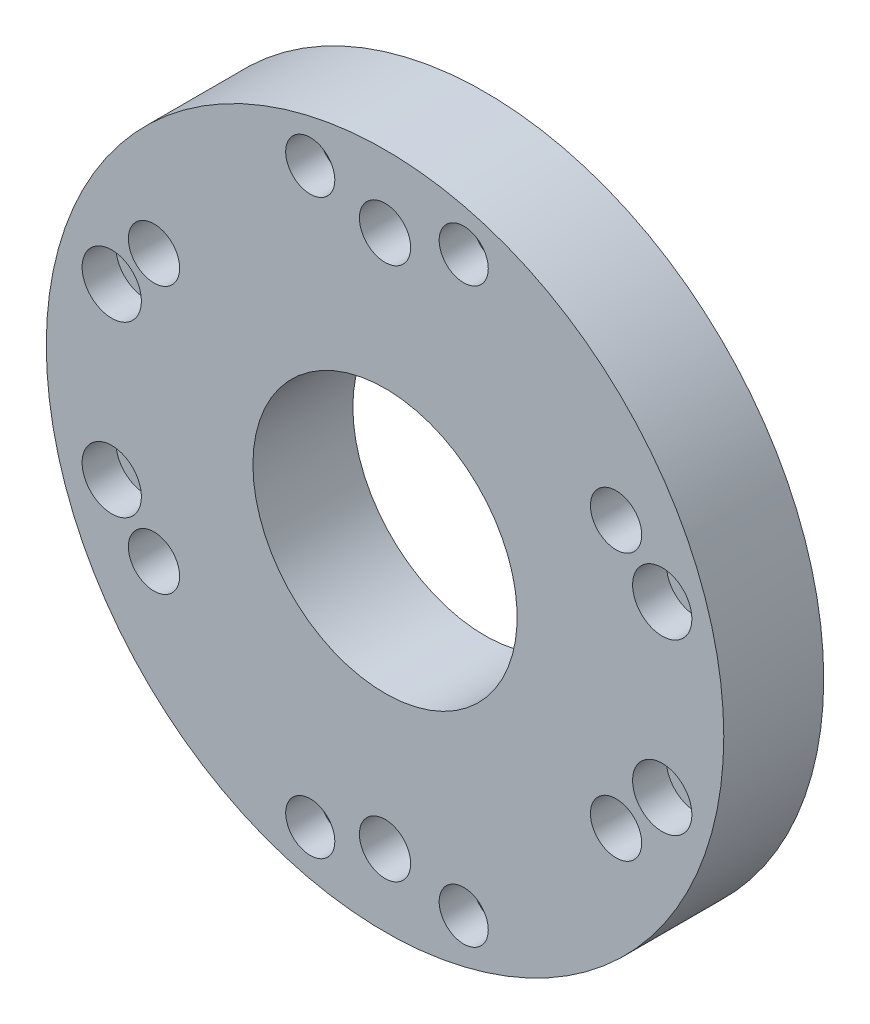
from build123d import *

# Parameters (mm, degrees)
SKETCH_1_R          = 40
EXTRUDE_1_DEPTH     = 11.8
SKETCH_2_R          = 2.15
SKETCH_2_R_2        = 1.75
CUT_EXTRUDE_1_DEPTH = 58.786157512
SKETCH_3_R          = 3.025
SKETCH_3_R_2        = 15.6
CUT_EXTRUDE_2_DEPTH = 58.786157512
SKETCH_5_R          = 2.9
SKETCH_5_R_2        = 3.5
CUT_EXTRUDE_4_DEPTH = 4


with BuildPart() as part:
    # 草图1 → 凸台-拉伸1 (new body)
    with BuildSketch(Plane.XY):
        Circle(SKETCH_1_R)
    extrude(amount=EXTRUDE_1_DEPTH)

    # 草图2 → 切除-拉伸1 (cut, through all)
    with BuildSketch(Plane(origin=(0, 0, 0), x_dir=(-1, 0, 0), z_dir=(0, 0, -1))):
        with Locations((-32.730643847, 10.1245665)):
            Circle(SKETCH_2_R)
        with Locations(Location((-32.730643847, -9.8754335, 0), (0, 0, 180))):
            Circle(SKETCH_2_R)
        with Locations((32.269356153, -9.8754335)):
            Circle(SKETCH_2_R)
        with Locations(Location((32.269356153, 10.1245665, 0), (0, 0, 180))):
            Circle(SKETCH_2_R)
        with Locations((-9.290643847, 33.9345665)):
            Circle(SKETCH_2_R_2)
        with Locations(Location((8.829356153, 33.9345665, 0), (0, 0, 180))):
            Circle(SKETCH_2_R_2)
        with Locations((8.829356153, -33.6854335)):
            Circle(SKETCH_2_R_2)
        with Locations(Location((-9.290643847, -33.6854335, 0), (0, 0, 180))):
            Circle(SKETCH_2_R_2)
    extrude(amount=-CUT_EXTRUDE_1_DEPTH, mode=Mode.SUBTRACT)

    # 草图3 → 切除-拉伸2 (cut, through all)
    with BuildSketch(Plane(origin=(0, 0, 0), x_dir=(-1, 0, 0), z_dir=(0, 0, -1))):
        with Locations((0, 31.5)):
            Circle(SKETCH_3_R)
        with Locations((27.279800219, 15.75)):
            Circle(SKETCH_3_R)
        with Locations((27.279800219, -15.75)):
            Circle(SKETCH_3_R)
        with Locations((0, -31.5)):
            Circle(SKETCH_3_R)
        with Locations((-27.279800219, -15.75)):
            Circle(SKETCH_3_R)
        with Locations((-27.279800219, 15.75)):
            Circle(SKETCH_3_R)
        Circle(SKETCH_3_R_2)
    extrude(amount=-CUT_EXTRUDE_2_DEPTH, mode=Mode.SUBTRACT)

    # 草图5 → 切除-拉伸4 (cut)
    with BuildSketch(Plane.XY.offset(11.8)):
        with Locations((-8.829356153, -33.6854335)):
            Circle(SKETCH_5_R)
        with Locations((-8.829356153, 33.9345665)):
            Circle(SKETCH_5_R)
        with Locations((-32.269356153, 10.1245665)):
            Circle(SKETCH_5_R_2)
        with Locations((-32.269356153, -9.8754335)):
            Circle(SKETCH_5_R_2)
        with Locations((9.290643847, 33.9345665)):
            Circle(SKETCH_5_R)
        with Locations((32.730643847, 10.1245665)):
            Circle(SKETCH_5_R_2)
        with Locations((32.730643847, -9.8754335)):
            Circle(SKETCH_5_R_2)
        with Locations((9.290643847, -33.6854335)):
            Circle(SKETCH_5_R)
    extrude(amount=-CUT_EXTRUDE_4_DEPTH, mode=Mode.SUBTRACT)


solid = part.part
